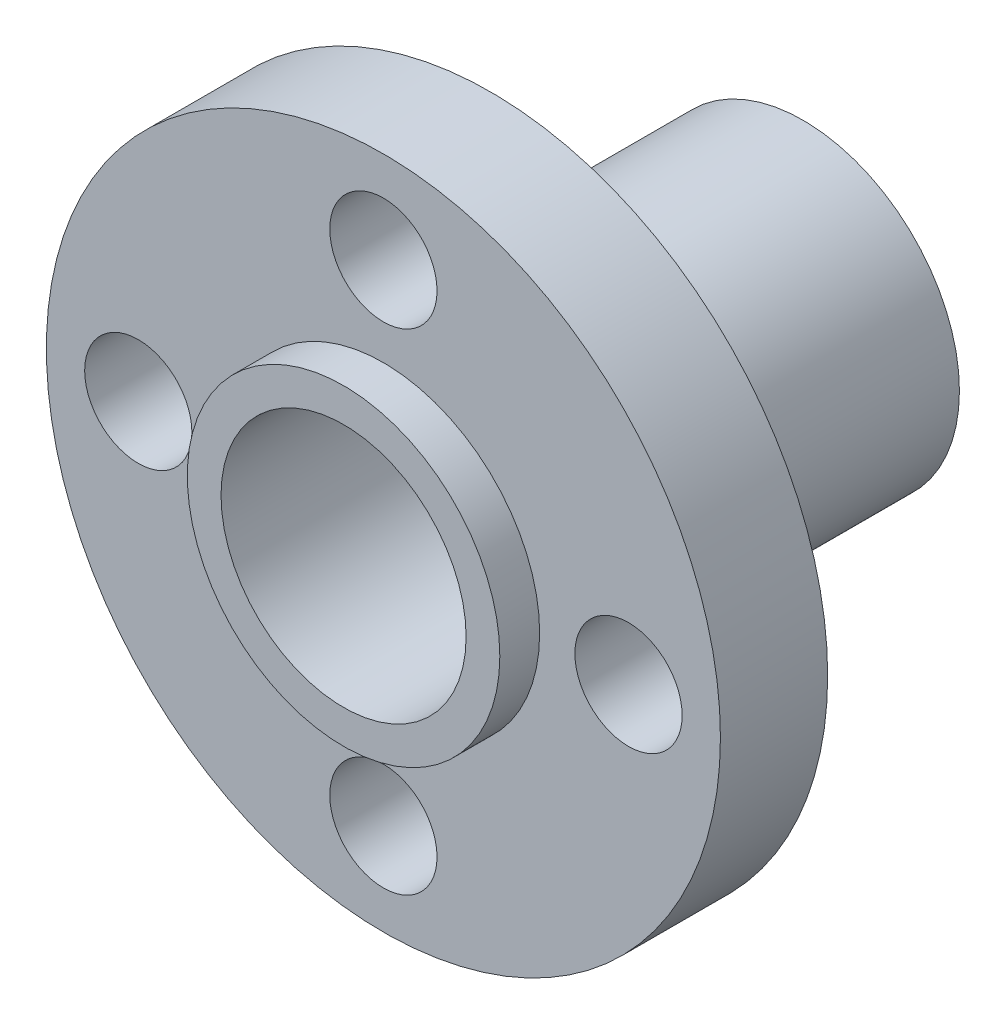
from build123d import *

# Parameters (mm, degrees)
SKETCH_1_R          = 5.1
SKETCH_1_R_2        = 4
EXTRUDE_1_DEPTH     = 15
EXTRUDE_START       = -4.8
SKETCH_2_R          = 11
SKETCH_2_R_2        = 5.1
EXTRUDE_2_DEPTH     = 3.5
SKETCH_3_R          = 1.75
CUT_EXTRUDE_1_DEPTH = 5


with BuildPart() as part:
    # 草图1 → 凸台-拉伸1 (new body)
    with BuildSketch(Plane.XY):
        Circle(SKETCH_1_R)
        Circle(SKETCH_1_R_2, mode=Mode.SUBTRACT)
    extrude(amount=EXTRUDE_1_DEPTH)

    # 草图2 → 凸台-拉伸2 (add)
    with BuildSketch(Plane.XY.offset(15).offset(EXTRUDE_START)):
        Circle(SKETCH_2_R)
        Circle(SKETCH_2_R_2, mode=Mode.SUBTRACT)
    extrude(amount=EXTRUDE_2_DEPTH)

    # 草图3 → 切除-拉伸1 (cut)
    with BuildSketch(Plane(origin=(0, 0, 10.2), x_dir=(-1, 0, 0), z_dir=(0, 0, -1))):
        with Locations((8, 0)):
            Circle(SKETCH_3_R)
        with Locations((0, -8)):
            Circle(SKETCH_3_R)
        with Locations((-8, 0)):
            Circle(SKETCH_3_R)
        with Locations((0, 8)):
            Circle(SKETCH_3_R)
    extrude(amount=-CUT_EXTRUDE_1_DEPTH, mode=Mode.SUBTRACT)


solid = part.part
